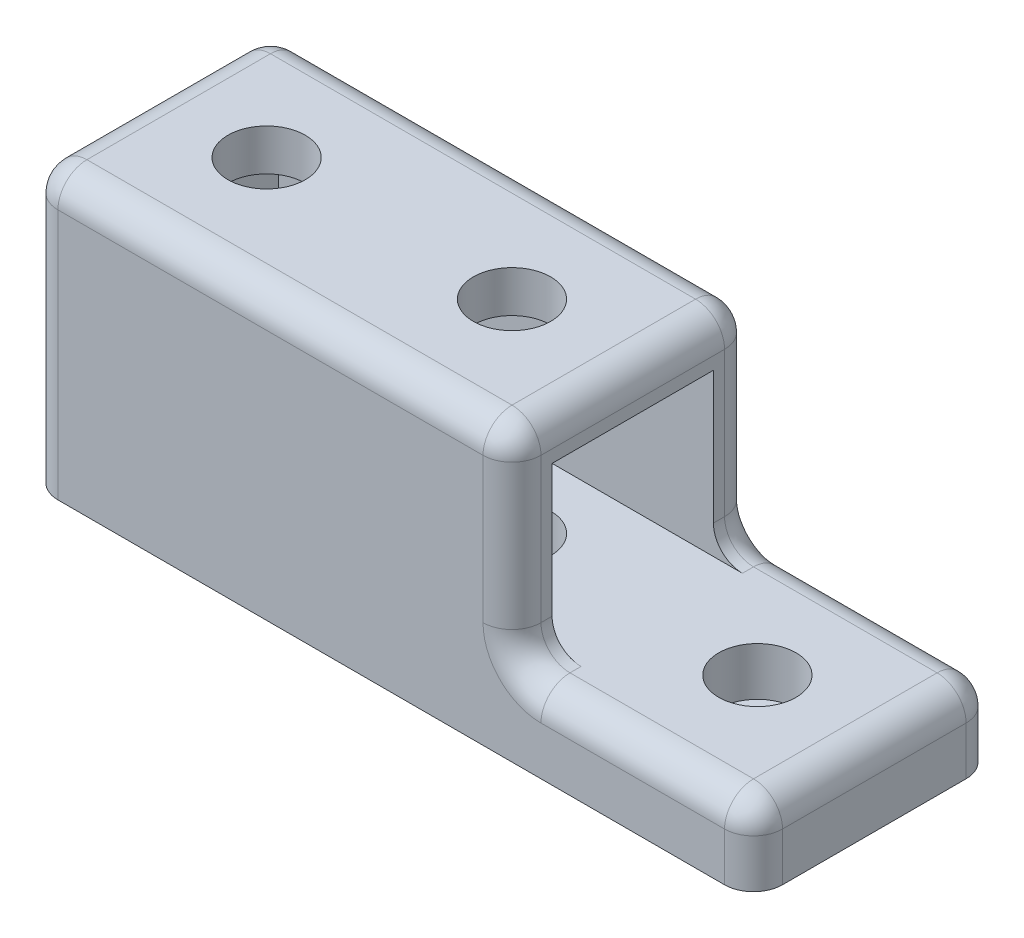
from build123d import *

# Parameters (mm, degrees)
SKETCH1_W               = 75
SKETCH1_H               = 25
BOSS_EXTRUDE1_DEPTH     = 8
SKETCH5_W               = 25
SKETCH5_H               = 21
BOSS_EXTRUDE2_DEPTH     = 50
SKETCH7_W               = 16.7
SKETCH7_H               = 16.7
CUT_EXTRUDE3_DEPTH      = 45
SKETCH4_R               = 2.38125
CUT_EXTRUDE2_DEPTH      = 50.025503567
CUT_EXTRUDE1_DEPTH      = 45.760473635
CUT_EXTRUDE1_DEPTH_BACK = 5
SKETCH3_R               = 4
FILLET1_R               = 3


with BuildPart() as part:
    # Sketch1 → Boss-Extrude1 (new body)
    with BuildSketch(Plane(origin=(0, 0, 0), x_dir=(1, 0, 0), z_dir=(0, 1, 0))):
        Rectangle(SKETCH1_W, SKETCH1_H)
    extrude(amount=BOSS_EXTRUDE1_DEPTH)

    # Sketch5 → Boss-Extrude2 (add)
    with BuildSketch(Plane.ZY.offset(37.5)):
        with Locations((0, 18.5)):
            Rectangle(SKETCH5_W, SKETCH5_H)
    extrude(amount=-BOSS_EXTRUDE2_DEPTH)

    # Sketch7 → Cut-Extrude3 (cut)
    with BuildSketch(Plane(origin=(12.5, 0, 0), x_dir=(0, 0, -1), z_dir=(1, 0, 0))):
        with Locations((0, 16.35)):
            Rectangle(SKETCH7_W, SKETCH7_H)
    extrude(amount=-CUT_EXTRUDE3_DEPTH, mode=Mode.SUBTRACT)

    # Sketch4 → Cut-Extrude2 (cut, through all)
    with BuildSketch(Plane(origin=(0, 0, 0), x_dir=(1, 0, 0), z_dir=(0, 1, 0))):
        with Locations(Location((0, 0, 0), (0, 0, 90))):
            Circle(SKETCH4_R)
        with Locations(Location((25.4, 0, 0), (0, 0, 90))):
            Circle(SKETCH4_R)
        with Locations(Location((-25.4, 0, 0), (0, 0, 90))):
            Circle(SKETCH4_R)
    extrude(amount=CUT_EXTRUDE2_DEPTH, mode=Mode.SUBTRACT)

    # Sketch3 → Cut-Extrude1 (cut, two sides: drawn at the far end of the back side and taken through both)
    with BuildSketch(Plane(origin=(0, 8, 0), x_dir=(1, 0, 0), z_dir=(0, 1, 0)).offset(-CUT_EXTRUDE1_DEPTH_BACK)):
        with Locations(Location((0, 0, 0), (0, 0, 90))):
            Circle(SKETCH3_R)
        with Locations(Location((25.4, 0, 0), (0, 0, 90))):
            Circle(SKETCH3_R)
        with Locations(Location((-25.4, 0, 0), (0, 0, 90))):
            Circle(SKETCH3_R)
    extrude(amount=CUT_EXTRUDE1_DEPTH + CUT_EXTRUDE1_DEPTH_BACK, mode=Mode.SUBTRACT)

    # Fillet1
    fillet1_edges = [part.edges().sort_by_distance(p)[0] for p in [
        (25, 8, 12.5),
        (12.5, 18.5, -12.5),
        (12.5, 29, 0),
        (-12.5, 29, -12.5),
        (12.5, 18.5, 12.5),
        (-12.5, 29, 12.5),
        (12.5, 8, -10.425),
        (-37.5, 29, 0),
        (12.5, 8, 10.425),
        (37.5, 8, 0),
        (37.5, 4, 12.5),
        (-37.5, 14.5, 12.5),
        (-37.5, 14.5, -12.5),
        (37.5, 4, -12.5),
        (25, 8, -12.5),
    ]]
    fillet(fillet1_edges, radius=FILLET1_R)


solid = part.part
